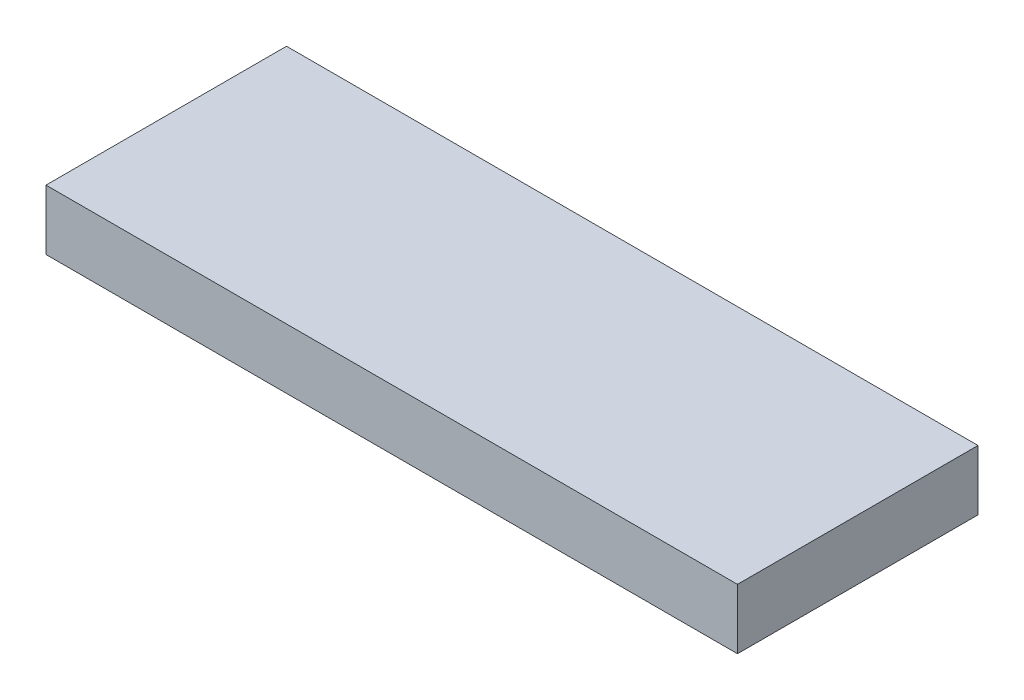
from build123d import *

# Parameters (mm, degrees)
SKETCH1_W           = 73.025
SKETCH1_H           = 25.4
BOSS_EXTRUDE1_DEPTH = 6.35


with BuildPart() as part:
    # Sketch1 → Boss-Extrude1 (new body)
    with BuildSketch(Plane(origin=(0, 0, 0), x_dir=(1, 0, 0), z_dir=(0, 1, 0))):
        with Locations((36.5125, 12.7)):
            Rectangle(SKETCH1_W, SKETCH1_H)
    extrude(amount=BOSS_EXTRUDE1_DEPTH)


solid = part.part
